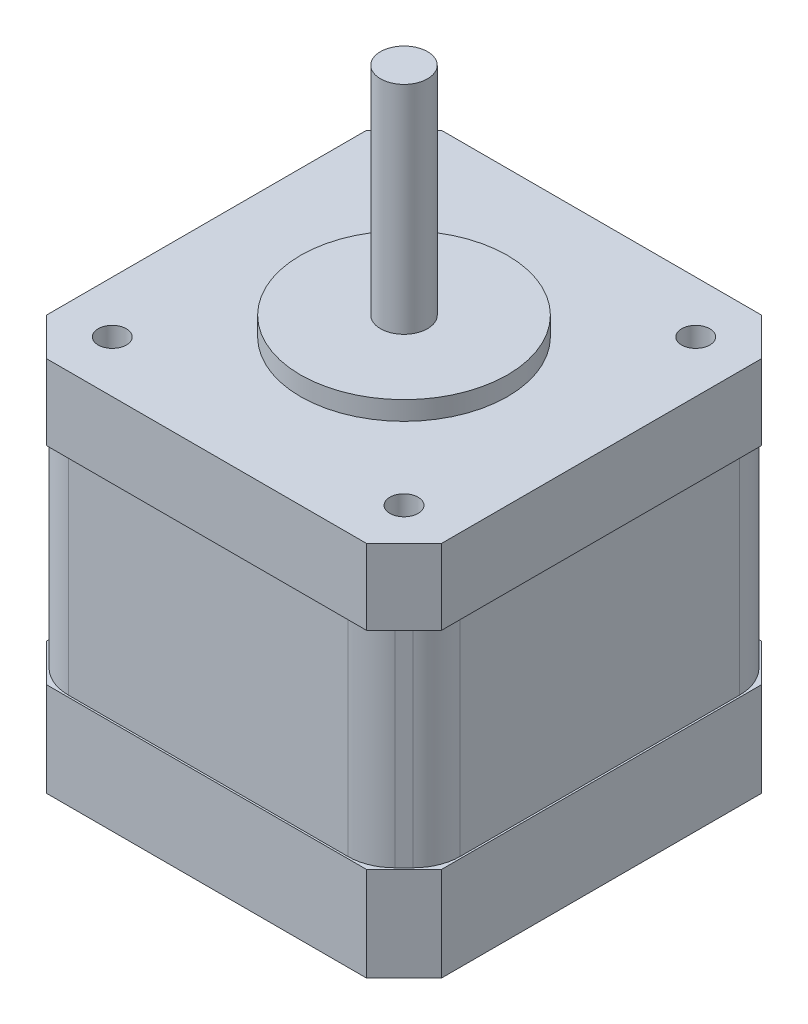
from build123d import *

# Parameters (mm, degrees)
BOSS_EXTRUDE1_DEPTH = 10
BOSS_EXTRUDE2_DEPTH = 22
SKETCH3_R           = 1.5
BOSS_EXTRUDE3_DEPTH = 8
SKETCH4_R           = 11
SKETCH4_R_2         = 2.5
BOSS_EXTRUDE4_DEPTH = 2
SKETCH6_R           = 2.5
BOSS_EXTRUDE5_DEPTH = 25


with BuildPart() as part:
    # Sketch1 → Boss-Extrude1 (new body)
    with BuildSketch(Plane(origin=(0, 0, 0), x_dir=(1, 0, 0), z_dir=(0, 1, 0))):
        Polygon((-21, 17), (-17, 21), (17, 21), (21, 17), (21, -17), (17, -21), (-17, -21), (-21, -17), align=None)
    extrude(amount=BOSS_EXTRUDE1_DEPTH)

    # Sketch2 → Boss-Extrude2 (add)
    with BuildSketch(Plane(origin=(0, 10, 0), x_dir=(1, 0, 0), z_dir=(0, 1, 0))):
        with BuildLine():
            Line((-19.335533906, 18.381623382), (-18.381623382, 19.335533906))
            ThreePointArc((-18.381623382, 19.335533906), (-16.759506637, 20.419397663), (-14.846089476, 20.8))
            Line((-14.846089476, 20.8), (14.846089476, 20.8))
            ThreePointArc((14.846089476, 20.8), (16.759506637, 20.419397663), (18.381623382, 19.335533906))
            Line((18.381623382, 19.335533906), (19.335533906, 18.381623382))
            ThreePointArc((19.335533906, 18.381623382), (20.419397663, 16.759506637), (20.8, 14.846089476))
            Line((20.8, 14.846089476), (20.8, -14.846089476))
            ThreePointArc((20.8, -14.846089476), (20.419397663, -16.759506637), (19.335533906, -18.381623382))
            Line((19.335533906, -18.381623382), (18.381623382, -19.335533906))
            ThreePointArc((18.381623382, -19.335533906), (16.759506637, -20.419397663), (14.846089476, -20.8))
            Line((14.846089476, -20.8), (-14.846089476, -20.8))
            ThreePointArc((-14.846089476, -20.8), (-16.759506637, -20.419397663), (-18.381623382, -19.335533906))
            Line((-18.381623382, -19.335533906), (-19.335533906, -18.381623382))
            ThreePointArc((-19.335533906, -18.381623382), (-20.419397663, -16.759506637), (-20.8, -14.846089476))
            Line((-20.8, -14.846089476), (-20.8, 14.846089476))
            ThreePointArc((-20.8, 14.846089476), (-20.419397663, 16.759506637), (-19.335533906, 18.381623382))
        make_face()
    extrude(amount=BOSS_EXTRUDE2_DEPTH)

    # Sketch3 → Boss-Extrude3 (add)
    # profile 1 of 2: a face of its own
    with BuildSketch(Plane(origin=(0, 32, 0), x_dir=(1, 0, 0), z_dir=(0, 1, 0))):
        Polygon((-17, 21), (-21, 17), (-21, -17), (-17, -21), (17, -21), (21, -17), (21, 17), (17, 21), align=None)
        with BuildLine():
            ThreePointArc((-14.846089476, 20.8), (-16.759506637, 20.419397663), (-18.381623382, 19.335533906))
            Line((-18.381623382, 19.335533906), (-19.335533906, 18.381623382))
            ThreePointArc((-19.335533906, 18.381623382), (-20.419397663, 16.759506637), (-20.8, 14.846089476))
            Line((-20.8, 14.846089476), (-20.8, -14.846089476))
            ThreePointArc((-20.8, -14.846089476), (-20.419397663, -16.759506637), (-19.335533906, -18.381623382))
            Line((-19.335533906, -18.381623382), (-18.381623382, -19.335533906))
            ThreePointArc((-18.381623382, -19.335533906), (-16.759506637, -20.419397663), (-14.846089476, -20.8))
            Line((-14.846089476, -20.8), (14.846089476, -20.8))
            ThreePointArc((14.846089476, -20.8), (16.759506637, -20.419397663), (18.381623382, -19.335533906))
            Line((18.381623382, -19.335533906), (19.335533906, -18.381623382))
            ThreePointArc((19.335533906, -18.381623382), (20.419397663, -16.759506637), (20.8, -14.846089476))
            Line((20.8, -14.846089476), (20.8, 14.846089476))
            ThreePointArc((20.8, 14.846089476), (20.419397663, 16.759506637), (19.335533906, 18.381623382))
            Line((19.335533906, 18.381623382), (18.381623382, 19.335533906))
            ThreePointArc((18.381623382, 19.335533906), (16.759506637, 20.419397663), (14.846089476, 20.8))
            Line((14.846089476, 20.8), (-14.846089476, 20.8))
        make_face(mode=Mode.SUBTRACT)
    # profile 2 of 2: a face of its own
    with BuildSketch(Plane(origin=(0, 32, 0), x_dir=(1, 0, 0), z_dir=(0, 1, 0))):
        with BuildLine():
            Line((14.846089476, 20.8), (-14.846089476, 20.8))
            ThreePointArc((-14.846089476, 20.8), (-16.759506637, 20.419397663), (-18.381623382, 19.335533906))
            Line((-18.381623382, 19.335533906), (-19.335533906, 18.381623382))
            ThreePointArc((-19.335533906, 18.381623382), (-20.419397663, 16.759506637), (-20.8, 14.846089476))
            Line((-20.8, 14.846089476), (-20.8, -14.846089476))
            ThreePointArc((-20.8, -14.846089476), (-20.419397663, -16.759506637), (-19.335533906, -18.381623382))
            Line((-19.335533906, -18.381623382), (-18.381623382, -19.335533906))
            ThreePointArc((-18.381623382, -19.335533906), (-16.759506637, -20.419397663), (-14.846089476, -20.8))
            Line((-14.846089476, -20.8), (14.846089476, -20.8))
            ThreePointArc((14.846089476, -20.8), (16.759506637, -20.419397663), (18.381623382, -19.335533906))
            Line((18.381623382, -19.335533906), (19.335533906, -18.381623382))
            ThreePointArc((19.335533906, -18.381623382), (20.419397663, -16.759506637), (20.8, -14.846089476))
            Line((20.8, -14.846089476), (20.8, 14.846089476))
            ThreePointArc((20.8, 14.846089476), (20.419397663, 16.759506637), (19.335533906, 18.381623382))
            Line((19.335533906, 18.381623382), (18.381623382, 19.335533906))
            ThreePointArc((18.381623382, 19.335533906), (16.759506637, 20.419397663), (14.846089476, 20.8))
        make_face()
        with Locations(Location((15.5, 15.5, 0), (0, 0, 270))):
            Circle(SKETCH3_R, mode=Mode.SUBTRACT)
        with Locations(Location((15.5, -15.5, 0), (0, 0, 270))):
            Circle(SKETCH3_R, mode=Mode.SUBTRACT)
        with Locations(Location((-15.5, 15.5, 0), (0, 0, 270))):
            Circle(SKETCH3_R, mode=Mode.SUBTRACT)
        with Locations(Location((-15.5, -15.5, 0), (0, 0, 270))):
            Circle(SKETCH3_R, mode=Mode.SUBTRACT)
    extrude(amount=BOSS_EXTRUDE3_DEPTH)

    # Sketch4 → Boss-Extrude4 (add)
    with BuildSketch(Plane(origin=(0, 40, 0), x_dir=(1, 0, 0), z_dir=(0, 1, 0))):
        with Locations(Location((0, 0, 0), (0, 0, 270))):
            Circle(SKETCH4_R)
        with Locations(Location((0, 0, 0), (0, 0, 270))):
            Circle(SKETCH4_R_2, mode=Mode.SUBTRACT)
    extrude(amount=BOSS_EXTRUDE4_DEPTH)

    # Sketch6 → Boss-Extrude5 (add)
    with BuildSketch(Plane(origin=(0, 40, 0), x_dir=(1, 0, 0), z_dir=(0, 1, 0))):
        with Locations(Location((0, 0, 0), (0, 0, 270))):
            Circle(SKETCH6_R)
    extrude(amount=BOSS_EXTRUDE5_DEPTH)


solid = part.part
